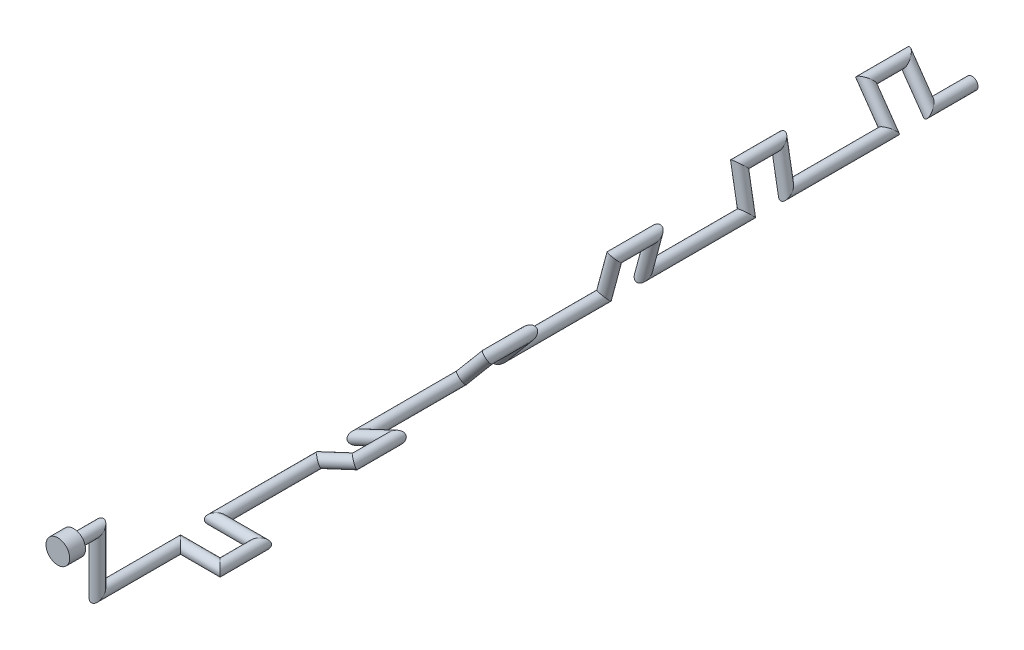
from build123d import *

# Parameters (mm, degrees)
SKETCH3_R           = 38.1
BOSS_EXTRUDE2_DEPTH = 50.8
SKETCH4_R           = 19.05
FILLET1_R           = 12.7
SKETCH5_R           = 19.05


with BuildPart() as part:
    # Sketch3 → Boss-Extrude2 (new body)
    with BuildSketch(Plane.XY):
        with Locations((0, 177.8)):
            Circle(SKETCH3_R)
    extrude(amount=BOSS_EXTRUDE2_DEPTH)

    # Sweep1: sweep along a curve in space
    with BuildLine() as sweep1_path:
        Line((0, 177.8, 0), (0, 177.8, -76.2))
        Line((0, 177.8, -76.2), (0, 0, -76.2))
        Line((0, 0, -76.2), (0, 0, -177.8))
    # Sketch4 → Sweep1 (sweep)
    with BuildSketch(Plane(origin=(0, 0, 0), x_dir=(-1, 0, 0), z_dir=(0, 0, -1))):
        with Locations((0, 177.8)):
            Circle(SKETCH4_R)
    sweep(path=sweep1_path.line, transition=Transition.RIGHT)

    # Fillet1
    fillet1_edges = [part.edges().sort_by_distance(p)[0] for p in [
        (19.05, 177.8, 0),
    ]]
    fillet(fillet1_edges, radius=FILLET1_R)

    # Sweep2: sweep along a curve in space
    with BuildLine() as sweep2_path:
        Line((0, 0, -177.8), (0, 0, -342.9))
        Line((0, 0, -342.9), (127, 0, -342.9))
        Line((127, 0, -342.9), (127, 0, -469.9))
        Line((127, 0, -469.9), (-12.7, 0, -469.9))
        Line((-12.7, 0, -469.9), (-12.7, 0, -800.1))
        Line((-12.7, 0, -800.1), (102.401088954, 53.669884385, -800.631819274))
        Line((102.401088954, 53.669884385, -800.631819274), (102.401088954, 53.669884385, -927.631819274))
        Line((-12.7, 0, -927.1), (102.401088954, 53.669884385, -927.631819274))
        Line((-12.7, 0, -927.1), (-12.7, 0, -1257.3))
        Line((-12.7, 0, -1257.3), (68.93402643, 97.28289786, -1258.260995676))
        Line((68.93402643, 97.28289786, -1258.260995676), (68.93402643, 97.28289786, -1385.260995676))
        Line((-12.7, 0, -1384.3), (68.93402643, 97.28289786, -1385.260995676))
        Line((-12.7, 0, -1384.3), (-12.7, 0, -1714.5))
        Line((-12.7, 0, -1714.5), (20.170018728, 122.672579939, -1714.5))
        Line((20.170018728, 122.672579939, -1714.5), (20.170018728, 122.672579939, -1841.5))
        Line((-12.7, 0, -1841.5), (20.170018728, 122.672579939, -1841.5))
        Line((-12.7, 0, -1841.5), (-12.7, 0, -2171.7))
        Line((-12.7, 0, -2171.7), (-34.753318564, 125.070584633, -2171.7))
        Line((-34.753318564, 125.070584633, -2171.7), (-34.753318564, 125.070584633, -2298.7))
        Line((-12.7, 0, -2298.7), (-34.753318564, 125.070584633, -2298.7))
        Line((-12.7, 0, -2298.7), (-12.7, 0, -2628.9))
        Line((-12.7, 0, -2628.9), (-85.544207417, 104.032309625, -2628.9))
        Line((-85.544207417, 104.032309625, -2628.9), (-85.544207417, 104.032309625, -2755.9))
        Line((-12.7, 0, -2755.9), (-85.544207417, 104.032309625, -2755.9))
        Line((-12.7, 0, -2755.9), (-12.7, 0, -2895.6))
    # Sketch5 → Sweep2 (sweep)
    with BuildSketch(Plane(origin=(0, 0, -177.8), x_dir=(-1, 0, 0), z_dir=(0, 0, -1))):
        Circle(SKETCH5_R)
    sweep(path=sweep2_path.line, transition=Transition.RIGHT)


solid = part.part
